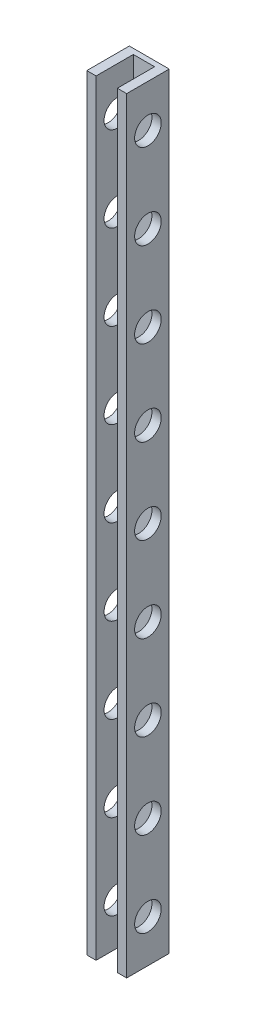
from build123d import *

# Parameters (mm, degrees)
BASE_DEPTH  = 144
ESQUISSE2_R = 2.5
TROU_DEPTH  = 145.250649912


with BuildPart() as part:
    # Esquisse1 → Base (new body)
    with BuildSketch(Plane(origin=(0, 0, 0), x_dir=(1, 0, 0), z_dir=(0, 1, 0))):
        Polygon((-2, -4), (-2, 3), (2, 3), (2, -4), (3.75, -4), (3.75, 4), (-3.75, 4), (-3.75, -4), align=None)
    extrude(amount=-BASE_DEPTH)

    # Esquisse2 → Trou (cut, through all)
    with BuildSketch(Plane.ZY.offset(3.75)):
        with Locations((0, -8)):
            Circle(ESQUISSE2_R)
        with Locations((0, -24)):
            Circle(ESQUISSE2_R)
        with Locations((0, -40)):
            Circle(ESQUISSE2_R)
        with Locations((0, -56)):
            Circle(ESQUISSE2_R)
        with Locations((0, -72)):
            Circle(ESQUISSE2_R)
        with Locations((0, -88)):
            Circle(ESQUISSE2_R)
        with Locations((0, -104)):
            Circle(ESQUISSE2_R)
        with Locations((0, -120)):
            Circle(ESQUISSE2_R)
        with Locations((0, -136)):
            Circle(ESQUISSE2_R)
    extrude(amount=-TROU_DEPTH, mode=Mode.SUBTRACT)


solid = part.part
